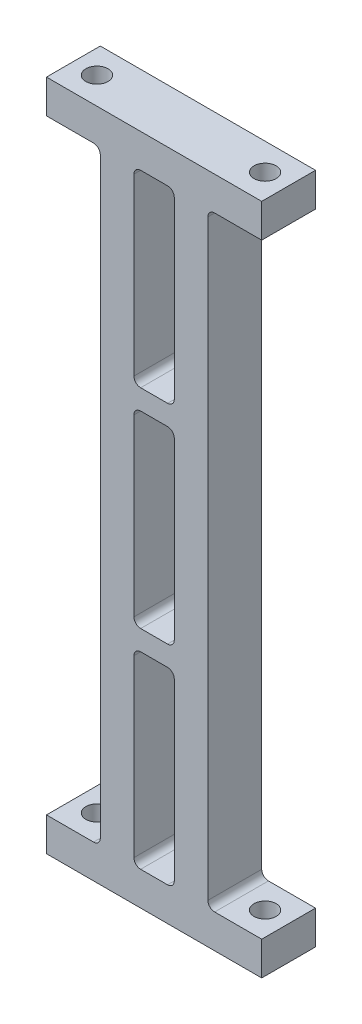
from build123d import *

# Parameters (mm, degrees)
EXTRUDE_1_DEPTH     = 8
FILLET_1_R          = 1
SKETCH_3_W          = 6
SKETCH_3_H          = 90
CUT_EXTRUDE_2_DEPTH = 10
FILLET_2_R          = 1
HOLE_WIZARD_M4_1_D  = 3.3
SKETCH_6_W          = 6
SKETCH_6_H          = 3
EXTRUDE_2_DEPTH     = 8
FILLET_3_R          = 1


with BuildPart() as part:
    # 草图1 → 凸台-拉伸1 (new body)
    with BuildSketch(Plane.XY):
        Polygon((8, 45), (8, -45), (16, -45), (16, -50), (-16, -50), (-16, -45), (-8, -45), (-8, 45), (-16, 45), (-16, 50), (16, 50), (16, 45), align=None)
    extrude(amount=EXTRUDE_1_DEPTH)

    # 圆角1
    fillet_1_edges = [part.edges().sort_by_distance(p)[0] for p in [
        (8, -45, 4),
        (-8, -45, 4),
        (-8, 45, 4),
        (8, 45, 4),
    ]]
    fillet(fillet_1_edges, radius=FILLET_1_R)

    # 草图3 → 切除-拉伸2 (cut)
    with BuildSketch(Plane.XY.offset(8)):
        Rectangle(SKETCH_3_W, SKETCH_3_H)
    extrude(amount=-CUT_EXTRUDE_2_DEPTH, mode=Mode.SUBTRACT)

    # 圆角2
    fillet_2_edges = [part.edges().sort_by_distance(p)[0] for p in [
        (3, 45, 4),
        (3, -45, 4),
        (-3, -45, 4),
        (-3, 45, 4),
    ]]
    fillet(fillet_2_edges, radius=FILLET_2_R)

    # M4 螺纹孔的螺纹孔钻头1 (through all)
    with Locations(Plane(origin=(0, -50, 0), x_dir=(-1, 0, 0), z_dir=(0, -1, 0))):
        with Locations((-12.5, -4), (12.5, -4)):
            Hole(HOLE_WIZARD_M4_1_D / 2)

    # 草图6 → 凸台-拉伸2 (add)
    with BuildSketch(Plane(origin=(0, 0, 0), x_dir=(-1, 0, 0), z_dir=(0, 0, -1))):
        with Locations((0, 15.5)):
            Rectangle(SKETCH_6_W, SKETCH_6_H)
        with Locations((0, -15.5)):
            Rectangle(SKETCH_6_W, SKETCH_6_H)
    extrude(amount=-EXTRUDE_2_DEPTH)

    # 圆角3
    fillet_3_edges = [part.edges().sort_by_distance(p)[0] for p in [
        (3, 17, 4),
        (3, 14, 4),
        (-3, 14, 4),
        (-3, 17, 4),
        (3, -14, 4),
        (3, -17, 4),
        (-3, -17, 4),
        (-3, -14, 4),
    ]]
    fillet(fillet_3_edges, radius=FILLET_3_R)


solid = part.part
